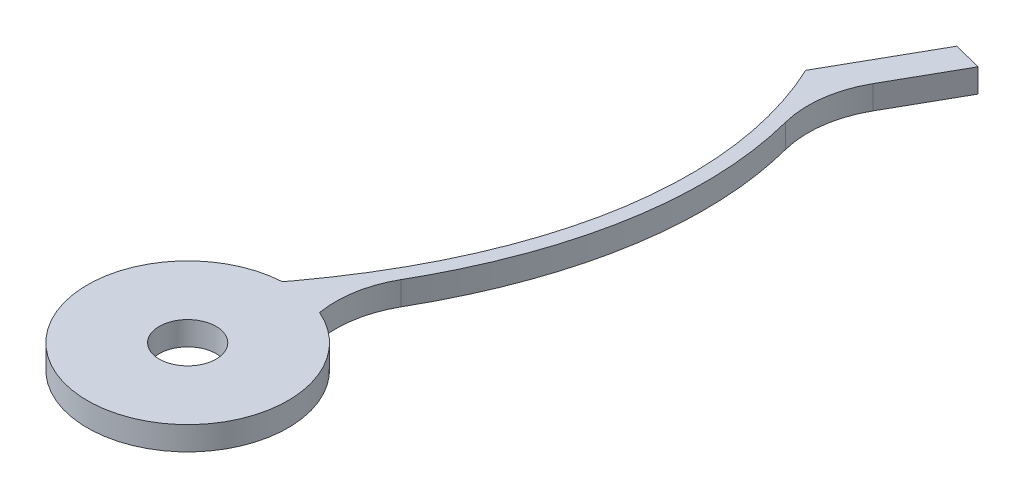
from build123d import *

# Parameters (mm, degrees)
SKETCH1_R           = 3
BOSS_EXTRUDE1_DEPTH = 2.5


with BuildPart() as part:
    # Sketch1 → Boss-Extrude1 (new body)
    with BuildSketch(Plane(origin=(0, 0, 0), x_dir=(1, 0, 0), z_dir=(0, 1, 0))):
        with BuildLine():
            Line((16.504384769, 67.001942846), (13.497620534, 67.780107201))
            Line((13.497620534, 67.780107201), (7.724071328, 57.579565356))
            add(Edge.make_bspline(
                [(-0.09847484, 11.22942621), (11.417322618, 26.843615689), (14.193248849, 43.730948361), (7.724071328, 57.579565356)],
                knots=[0.117374877, 0.117374877, 0.117374877, 0.117374877, 0.726153686, 0.726153686, 0.726153686, 0.726153686], degree=3))
            ThreePointArc((-0.09847484, 11.22942621), (-0.351961708, 10.90026492), (-0.618902028, 10.581916664))
            ThreePointArc((-0.618902028, 10.581916664), (-1.844722259, -10.438246969), (4.208359749, 9.728808161))
            ThreePointArc((4.208359749, 9.728808161), (4.214374117, 13.50532277), (5.497341127, 17.05723696))
            add(Edge.make_bspline(
                [(5.497341127, 17.05723696), (6.247224749, 18.369564751), (6.949389536, 19.705033958), (7.925084618, 21.74584693), (8.237367579, 22.432397455), (8.834853314, 23.818631134), (9.120431061, 24.519332655), (10.471450422, 28.041849379), (11.3095387, 30.920313304), (12.007053004, 34.605583669), (12.12890822, 35.347032839), (12.335497702, 36.839176051), (12.420373432, 37.591640588), (12.615035285, 39.850848786), (12.664547894, 41.35101651), (12.566324851, 45.833161956), (12.175786709, 48.797076432), (11.415069816, 51.733451528)],
                knots=[0, 0, 0, 0, 0.125, 0.125, 0.1875, 0.1875, 0.25, 0.25, 0.5, 0.5, 0.5625, 0.5625, 0.625, 0.625, 0.75, 0.75, 1, 1, 1, 1], degree=3))
            ThreePointArc((11.415069816, 51.733451528), (11.157464025, 55.926562312), (12.490570585, 59.910450575))
            Line((12.490570585, 59.910450575), (16.504384769, 67.001942846))
        make_face()
        with Locations(Location((0, 0, 0), (0, 0, 270))):
            Circle(SKETCH1_R, mode=Mode.SUBTRACT)
    extrude(amount=BOSS_EXTRUDE1_DEPTH)


solid = part.part
